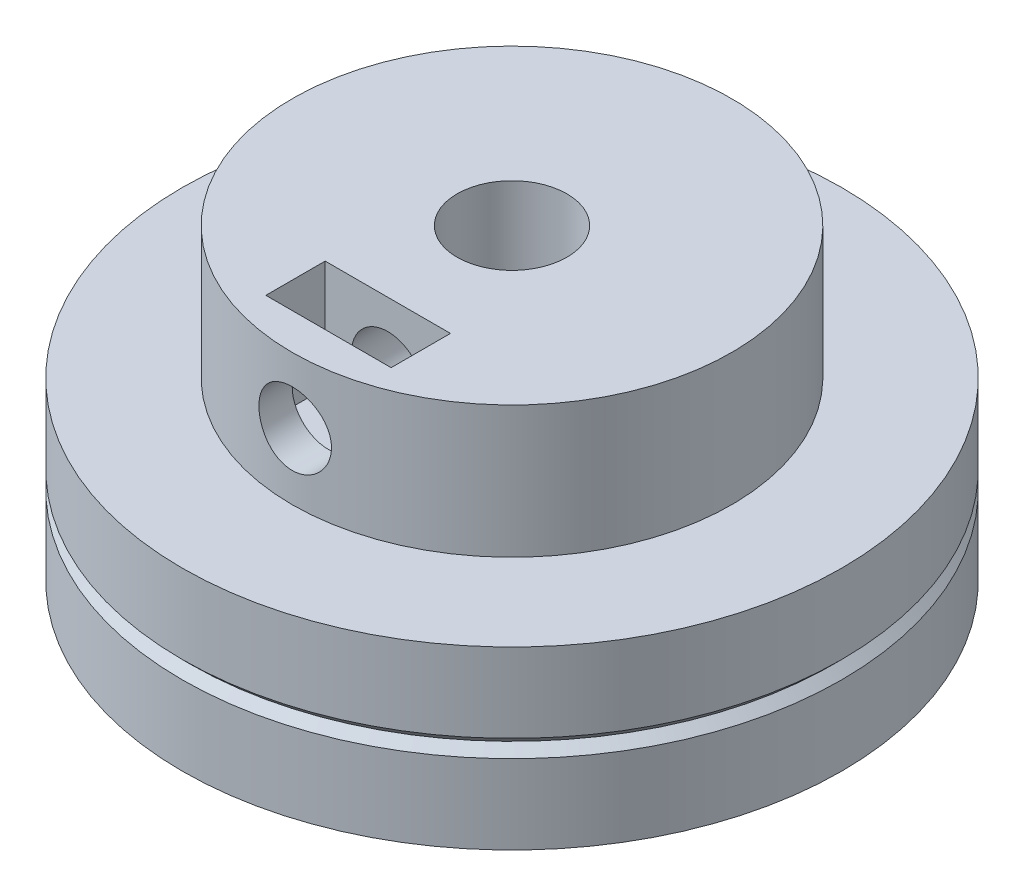
from build123d import *

# Parameters (mm, degrees)
BOSS_EXTRUDE1_START = 6
SKETCH2_R           = 10
SKETCH2_R_2         = 2.5
BOSS_EXTRUDE1_DEPTH = 6
SKETCH3_W           = 5.7
SKETCH3_H           = 2.7
CUT_EXTRUDE1_DEPTH  = 5
SKETCH4_R           = 1.65
CUT_EXTRUDE2_DEPTH  = 35


with BuildPart() as part:
    # Sketch1 → Revolve1 (revolve)
    with BuildSketch(Plane.XY, mode=Mode.PRIVATE) as revolve1_sk:
        Polygon((2.5, 8), (15, 8), (15, 4.4), (14.6, 4), (15, 3.6), (15, 0), (2.5, 0), align=None)
    revolve(revolve1_sk.sketch.rotate(Axis((0, 0, 0), (0, 1, 0)), 90), axis=Axis((0, 0, 0), (0, 1, 0)))

    # Sketch2 → Boss-Extrude1 (add)
    with BuildSketch(Plane(origin=(0, 8, 0), x_dir=(1, 0, 0), z_dir=(0, 1, 0)).offset(BOSS_EXTRUDE1_START)):
        with Locations(Location((0, 0, 0), (0, 0, 270))):
            Circle(SKETCH2_R)
        with Locations(Location((0, 0, 0), (0, 0, 90))):
            Circle(SKETCH2_R_2, mode=Mode.SUBTRACT)
    extrude(amount=-BOSS_EXTRUDE1_DEPTH)

    # Sketch3 → Cut-Extrude1 (cut)
    with BuildSketch(Plane(origin=(0, 14, 0), x_dir=(1, 0, 0), z_dir=(0, 1, 0))):
        with Locations((0, -7)):
            Rectangle(SKETCH3_W, SKETCH3_H)
    extrude(amount=-CUT_EXTRUDE1_DEPTH, mode=Mode.SUBTRACT)

    # Sketch4 → Cut-Extrude2 (cut)
    with BuildSketch(Plane.XY):
        with Locations(Location((0, 11, 0), (0, 0, 180))):
            Circle(SKETCH4_R)
    extrude(amount=CUT_EXTRUDE2_DEPTH, mode=Mode.SUBTRACT)


solid = part.part
